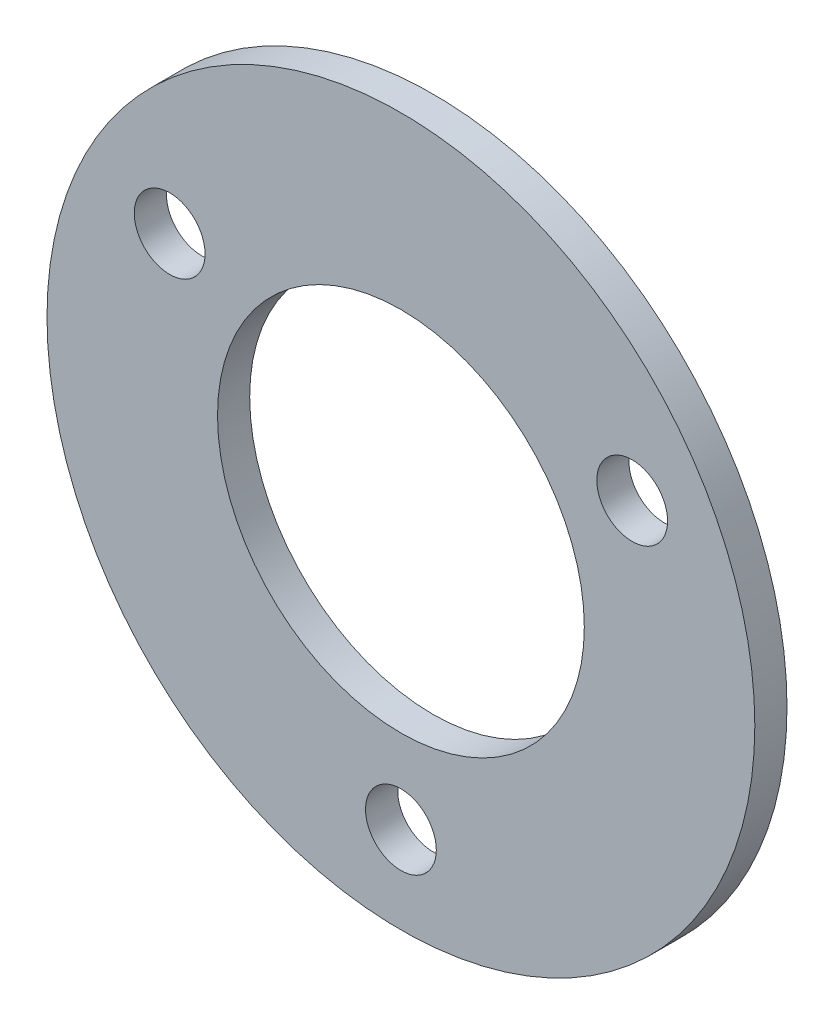
from build123d import *

# Parameters (mm, degrees)
SKETCH1_R         = 11
SKETCH1_R_2       = 5.7
SKETCH1_R_3       = 1.1
BEARING_CAP_DEPTH = 1


with BuildPart() as part:
    # Sketch1 → Bearing_Cap (new body)
    with BuildSketch(Plane.XY):
        Circle(SKETCH1_R)
        Circle(SKETCH1_R_2, mode=Mode.SUBTRACT)
        with Locations((7.188010851, 4.15)):
            Circle(SKETCH1_R_3, mode=Mode.SUBTRACT)
        with Locations((-7.188010851, 4.15)):
            Circle(SKETCH1_R_3, mode=Mode.SUBTRACT)
        with Locations((0, -8.3)):
            Circle(SKETCH1_R_3, mode=Mode.SUBTRACT)
    extrude(amount=BEARING_CAP_DEPTH)


solid = part.part
